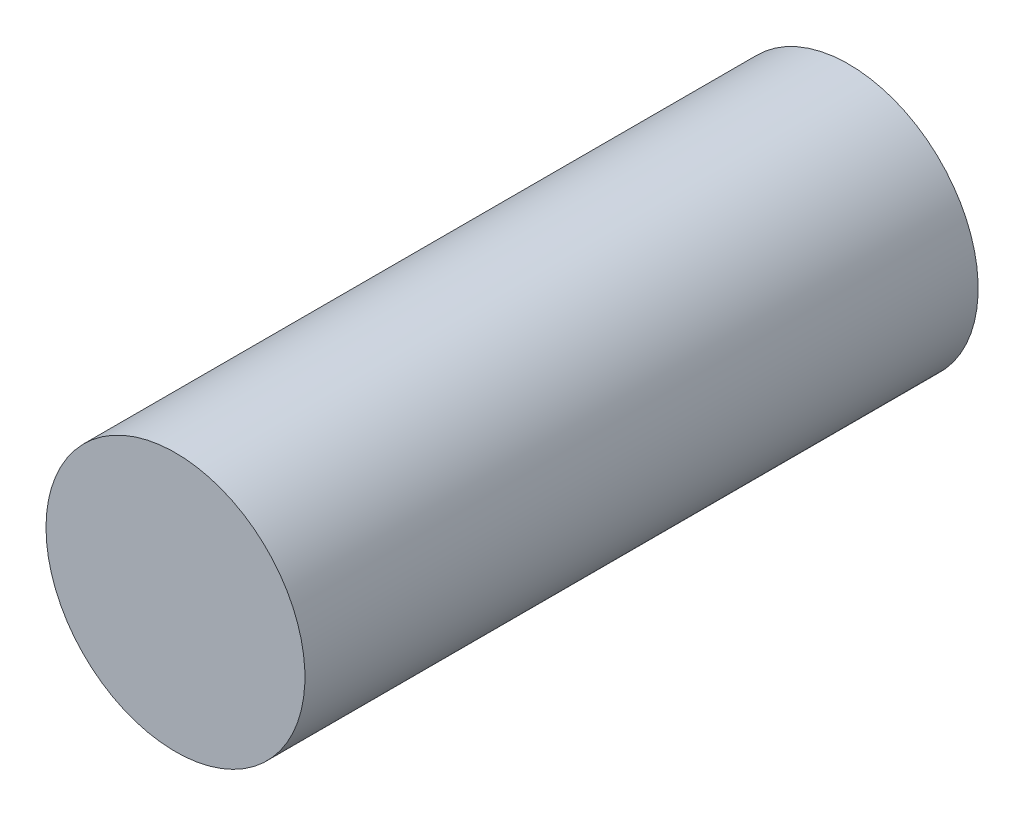
from build123d import *

# Parameters (mm, degrees)
BODY_SKETCH_R = 2.5
BODY_DEPTH    = 13


with BuildPart() as part:
    # Body sketch → Body (new body)
    with BuildSketch(Plane.XY):
        with Locations(Location((0, 0, 0), (0, 0, 180))):
            Circle(BODY_SKETCH_R)
    extrude(amount=BODY_DEPTH)


solid = part.part
